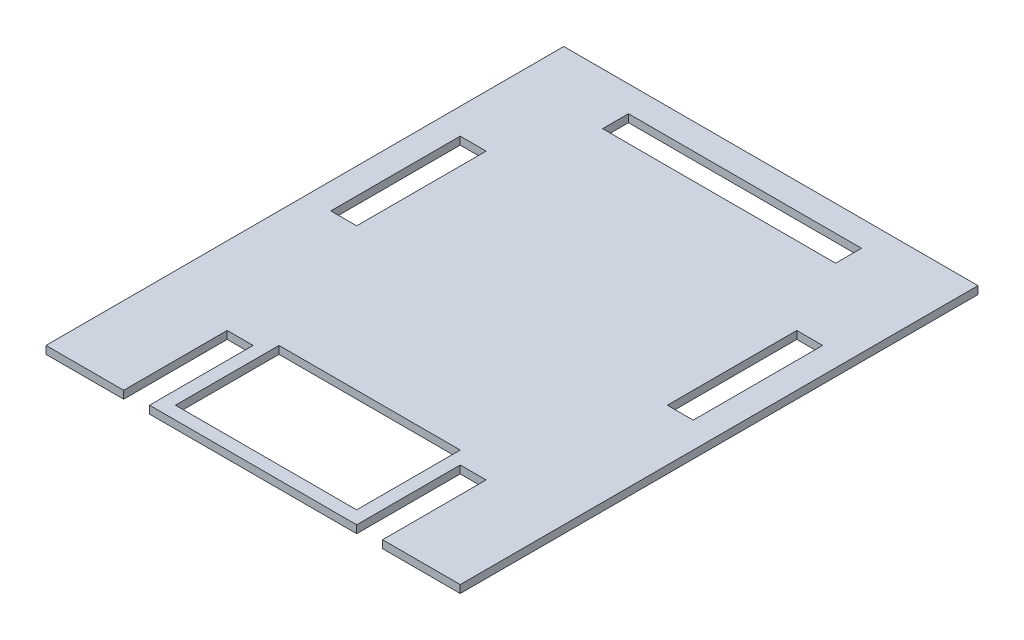
from build123d import *

# Parameters (mm, degrees)
SKETCH1_W           = 70
SKETCH1_H           = 40
SKETCH1_W_2         = 90
SKETCH1_H_2         = 10
SKETCH1_W_3         = 10
SKETCH1_H_3         = 50
BOSS_EXTRUDE1_DEPTH = 3


with BuildPart() as part:
    # Sketch1 → Boss-Extrude1 (new body)
    with BuildSketch(Plane(origin=(0, 0, 0), x_dir=(1, 0, 0), z_dir=(0, 1, 0))):
        Polygon((50.939044481, 91.268533773), (-109.060955519, 91.268533773), (-109.060955519, -108.731466227), (-79.060955519, -108.731466227), (-79.060955519, -68.731466227), (-69.060955519, -68.731466227), (-69.060955519, -108.731466227), (10.939044481, -108.731466227), (10.939044481, -68.731466227), (20.939044481, -68.731466227), (20.939044481, -108.731466227), (50.939044481, -108.731466227), align=None)
        with Locations((-29.060955519, -83.731466227)):
            Rectangle(SKETCH1_W, SKETCH1_H, mode=Mode.SUBTRACT)
        with Locations((-29.060955519, 76.268533773)):
            Rectangle(SKETCH1_W_2, SKETCH1_H_2, mode=Mode.SUBTRACT)
        with Locations((35.939044481, 16.268533773)):
            Rectangle(SKETCH1_W_3, SKETCH1_H_3, mode=Mode.SUBTRACT)
        with Locations((-94.060955519, 16.268533773)):
            Rectangle(SKETCH1_W_3, SKETCH1_H_3, mode=Mode.SUBTRACT)
    extrude(amount=BOSS_EXTRUDE1_DEPTH)


solid = part.part
